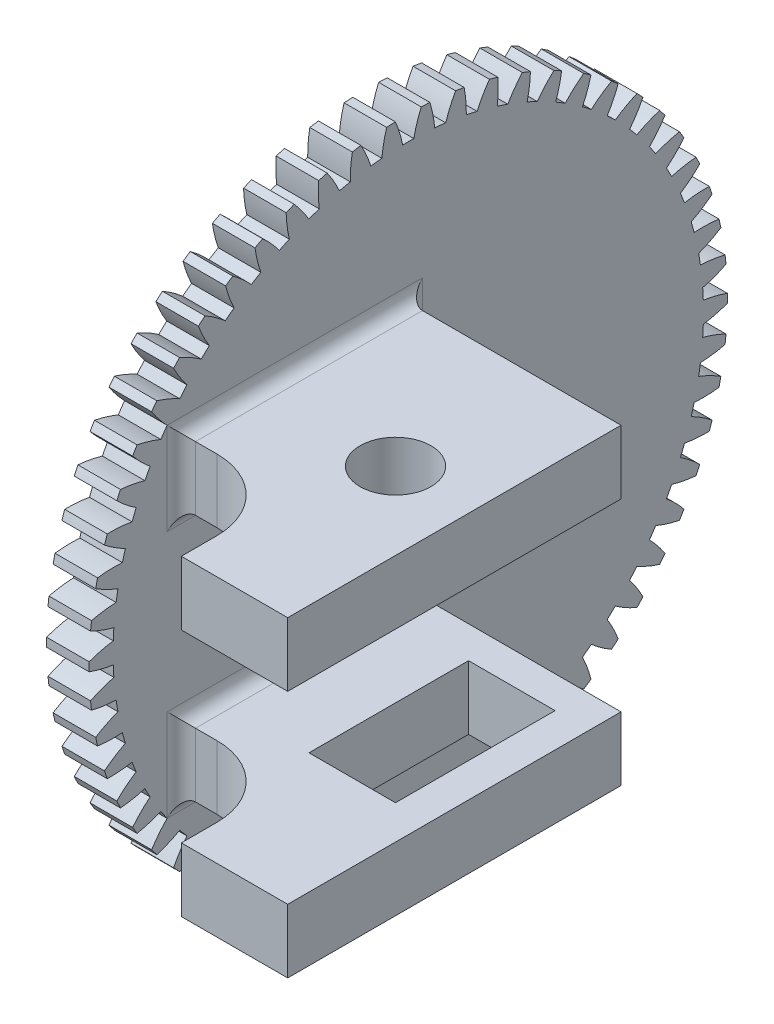
from build123d import *

# Parameters (mm, degrees)
BASPROSKE_W             = 6
BASPROSKE_H             = 45
TOOTHCUT_DEPTH          = 64.921827258
TEETHCUTS_COUNT         = 58
TEETHCUTS_ANGLE         = 353.793103448
BORSKE_R                = 4
BORE_DEPTH              = 50.0000508
ESQUISSE1_R             = 10
ENL_V_MAT_EXTRU_1_DEPTH = 64.895829376
ESQUISSE2_W             = 32
ESQUISSE2_H             = 9
BOSS_EXTRU_1_DEPTH      = 30
ESQUISSE6_W             = 12.2
ESQUISSE6_H             = 22.5
ENL_V_MAT_EXTRU_4_DEPTH = 10
CONG_1_R                = 2
ESQUISSE8_R             = 5
ENL_V_MAT_EXTRU_5_DEPTH = 17
ESQUISSE9_W             = 15
ESQUISSE9_H             = 9
BOSS_EXTRU_2_DEPTH      = 15
CONG_2_R                = 10


with BuildPart() as part:
    # BasProSke → Base-Revolve (revolve)
    with BuildSketch(Plane(origin=(0, 0, 0), x_dir=(1, 0, 0), z_dir=(0, 1, 0)), mode=Mode.PRIVATE) as base_revolve_sk:
        with Locations((3, 22.5)):
            Rectangle(BASPROSKE_W, BASPROSKE_H)
    revolve(base_revolve_sk.sketch.rotate(Axis((-10, 0, 0), (1, 0, 0)), 180), axis=Axis((-10, 0, 0), (1, 0, 0)))

    # TooCutSke → ToothCut (cut, through all)
    with BuildSketch(Plane(origin=(0, 0, 0), x_dir=(0, 0, -1), z_dir=(1, 0, 0))):
        with BuildLine():
            ThreePointArc((0.782825971, 41.616638013), (0, 41.624), (-0.782825971, 41.616638013))
            ThreePointArc((-0.782825971, 41.616638013), (-1.22244228, 43.329069308), (-1.833559466, 44.98805069))
            ThreePointArc((-1.833559466, 44.98805069), (0, 45.0254), (1.833559466, 44.98805069))
            ThreePointArc((1.833559466, 44.98805069), (1.22244228, 43.329069308), (0.782825971, 41.616638013))
        make_face()
    toothcut = extrude(amount=TOOTHCUT_DEPTH, mode=Mode.SUBTRACT)

    # TeethCuts: ToothCut ×58 about axis
    teethcuts_axis = Axis((-10, 0, 0), (1, 0, 0))
    for i in range(1, TEETHCUTS_COUNT):
        add(toothcut.rotate(teethcuts_axis, i * TEETHCUTS_ANGLE / (TEETHCUTS_COUNT - 1)), mode=Mode.SUBTRACT)

    # BorSke → Bore (cut, symmetric)
    with BuildSketch(Plane(origin=(0, 0, 0), x_dir=(0, 0, -1), z_dir=(1, 0, 0))):
        with Locations(Location((0, 0, 0), (0, 0, 180))):
            Circle(BORSKE_R)
    extrude(amount=BORE_DEPTH, both=True, mode=Mode.SUBTRACT)

    # Esquisse1 → Enlèv. mat.-Extru.1 (cut, through all)
    with BuildSketch(Plane(origin=(6, 0, 0), x_dir=(0, 0, -1), z_dir=(1, 0, 0))):
        Circle(ESQUISSE1_R)
    extrude(amount=-ENL_V_MAT_EXTRU_1_DEPTH, mode=Mode.SUBTRACT)

    # Esquisse2 → Boss.-Extru.1 (add)
    with BuildSketch(Plane(origin=(6, 0, 0), x_dir=(0, 0, -1), z_dir=(1, 0, 0))):
        with Locations((-16, 17.5)):
            Rectangle(ESQUISSE2_W, ESQUISSE2_H)
        with Locations((-16, -17.5)):
            Rectangle(ESQUISSE2_W, ESQUISSE2_H)
    extrude(amount=BOSS_EXTRU_1_DEPTH)

    # Esquisse6 → Enlèv. mat.-Extru.4 (cut)
    with BuildSketch(Plane.XZ.offset(22)):
        with Locations((25.1, 15.75)):
            Rectangle(ESQUISSE6_W, ESQUISSE6_H)
    extrude(amount=-ENL_V_MAT_EXTRU_4_DEPTH, mode=Mode.SUBTRACT)

    # Congé1
    cong_1_edges = [part.edges().sort_by_distance(p)[0] for p in [
        (6, 13, 16),
        (6, 17.5, 0),
        (6, 22, 16),
        (6, 17.5, 32),
        (6, -17.5, 32),
        (6, -13, 16),
        (6, -17.5, 0),
        (6, -22, 16),
    ]]
    fillet(cong_1_edges, radius=CONG_1_R)

    # Esquisse8 → Enlèv. mat.-Extru.5 (cut)
    with BuildSketch(Plane(origin=(0, 22, 0), x_dir=(1, 0, 0), z_dir=(0, 1, 0))):
        with Locations(Location((25.1, -20.9, 0), (0, 0, 270))):
            Circle(ESQUISSE8_R)
    extrude(amount=-ENL_V_MAT_EXTRU_5_DEPTH, mode=Mode.SUBTRACT)

    # Esquisse9 → Boss.-Extru.2 (add)
    with BuildSketch(Plane.XY.offset(32)):
        with Locations((28.5, 17.5)):
            Rectangle(ESQUISSE9_W, ESQUISSE9_H)
        with Locations((28.5, -17.5)):
            Rectangle(ESQUISSE9_W, ESQUISSE9_H)
    extrude(amount=BOSS_EXTRU_2_DEPTH)

    # Congé2
    cong_2_edges = [part.edges().sort_by_distance(p)[0] for p in [
        (21, 17.5, 32),
        (21, -17.5, 32),
    ]]
    fillet(cong_2_edges, radius=CONG_2_R)


solid = part.part
